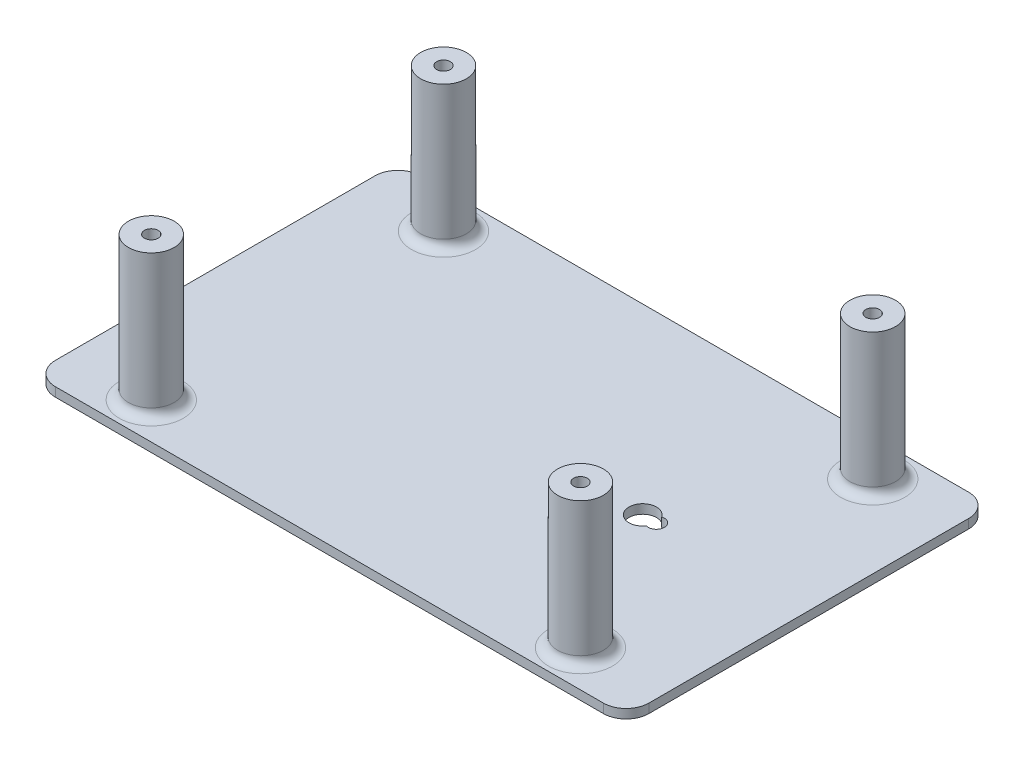
from build123d import *

# Parameters (mm, degrees)
EXTRUDE_1_DEPTH     = 2
SKETCH_2_R          = 3.25
CUT_EXTRUDE_1_DEPTH = 2
EXTRUDE_START       = 31.4
SKETCH_5_R          = 5
SKETCH_5_R_2        = 3.25
EXTRUDE_2_DEPTH     = 31.4
FILLET_1_R          = 2
SKETCH_6_R          = 4.098076989
SKETCH_6_R_2        = 1.5
SKETCH_6_R_3        = 4.302303052
SKETCH_6_R_4        = 4.211102699
SKETCH_6_R_5        = 4.115212329
EXTRUDE_3_DEPTH     = 15
FILLET_2_R          = 2
CUT_EXTRUDE_2_DEPTH = 15


with BuildPart() as part:
    # Эскиз1 → Бобышка-Вытянуть1 (new body)
    with BuildSketch(Plane(origin=(0, 0, 0), x_dir=(1, 0, 0), z_dir=(0, 1, 0))):
        with BuildLine():
            Line((-60, 40), (60, 40))
            ThreePointArc((60, 40), (63.535533906, 38.535533906), (65, 35))
            Line((65, 35), (65, -35))
            ThreePointArc((65, -35), (63.535533906, -38.535533906), (60, -40))
            Line((60, -40), (-60, -40))
            ThreePointArc((-60, -40), (-63.535533906, -38.535533906), (-65, -35))
            Line((-65, -35), (-65, 35))
            ThreePointArc((-65, 35), (-63.535533906, 38.535533906), (-60, 40))
        make_face()
    extrude(amount=EXTRUDE_1_DEPTH)

    # Эскиз2 → Вырез-Вытянуть1 (cut)
    with BuildSketch(Plane(origin=(0, 2, 0), x_dir=(1, 0, 0), z_dir=(0, 1, 0))):
        with Locations(Location((-47, 32, 0), (0, 0, 270))):
            Circle(SKETCH_2_R)
        with Locations(Location((47, 32, 0), (0, 0, 270))):
            Circle(SKETCH_2_R)
        with Locations(Location((-47, -32, 0), (0, 0, 270))):
            Circle(SKETCH_2_R)
        with Locations(Location((47, -32, 0), (0, 0, 270))):
            Circle(SKETCH_2_R)
    extrude(amount=-CUT_EXTRUDE_1_DEPTH, mode=Mode.SUBTRACT)

    # Эскиз5 → Бобышка-Вытянуть2 (add)
    # profile 1 of 4: a face of its own
    with BuildSketch(Plane(origin=(0, 2, 0), x_dir=(1, 0, 0), z_dir=(0, 1, 0)).offset(EXTRUDE_START)):
        with Locations(Location((-47, 32, 0), (0, 0, 90))):
            Circle(SKETCH_5_R)
        with Locations(Location((-47, 32, 0), (0, 0, 270))):
            Circle(SKETCH_5_R_2, mode=Mode.SUBTRACT)
    # profile 2 of 4: a face of its own
    with BuildSketch(Plane(origin=(0, 2, 0), x_dir=(1, 0, 0), z_dir=(0, 1, 0)).offset(EXTRUDE_START)):
        with Locations(Location((47, 32, 0), (0, 0, 90))):
            Circle(SKETCH_5_R)
        with Locations(Location((47, 32, 0), (0, 0, 270))):
            Circle(SKETCH_5_R_2, mode=Mode.SUBTRACT)
    # profile 3 of 4: a face of its own
    with BuildSketch(Plane(origin=(0, 2, 0), x_dir=(1, 0, 0), z_dir=(0, 1, 0)).offset(EXTRUDE_START)):
        with Locations(Location((47, -32, 0), (0, 0, 90))):
            Circle(SKETCH_5_R)
        with Locations(Location((47, -32, 0), (0, 0, 270))):
            Circle(SKETCH_5_R_2, mode=Mode.SUBTRACT)
    # profile 4 of 4: a face of its own
    with BuildSketch(Plane(origin=(0, 2, 0), x_dir=(1, 0, 0), z_dir=(0, 1, 0)).offset(EXTRUDE_START)):
        with Locations(Location((-47, -32, 0), (0, 0, 90))):
            Circle(SKETCH_5_R)
        with Locations(Location((-47, -32, 0), (0, 0, 270))):
            Circle(SKETCH_5_R_2, mode=Mode.SUBTRACT)
    extrude(amount=-EXTRUDE_2_DEPTH)

    # Скругление1
    fillet_1_edges = [part.edges().sort_by_distance(p)[0] for p in [
        (-47, 2, -27),
        (47, 2, 37),
        (47, 2, -27),
        (-47, 2, 37),
    ]]
    fillet(fillet_1_edges, radius=FILLET_1_R)

    # Эскиз6 → Бобышка-Вытянуть3 (add)
    # profile 1 of 4: a face of its own
    with BuildSketch(Plane(origin=(0, 33.4, 0), x_dir=(1, 0, 0), z_dir=(0, 1, 0))):
        with Locations((-47, 32)):
            Circle(SKETCH_6_R)
        with Locations(Location((-47, 32, 0), (0, 0, 270))):
            Circle(SKETCH_6_R_2, mode=Mode.SUBTRACT)
    # profile 2 of 4: a face of its own
    with BuildSketch(Plane(origin=(0, 33.4, 0), x_dir=(1, 0, 0), z_dir=(0, 1, 0))):
        with Locations((47, 32)):
            Circle(SKETCH_6_R_3)
        with Locations(Location((47, 32, 0), (0, 0, 270))):
            Circle(SKETCH_6_R_2, mode=Mode.SUBTRACT)
    # profile 3 of 4: a face of its own
    with BuildSketch(Plane(origin=(0, 33.4, 0), x_dir=(1, 0, 0), z_dir=(0, 1, 0))):
        with Locations((47, -32)):
            Circle(SKETCH_6_R_4)
        with Locations(Location((47, -32, 0), (0, 0, 270))):
            Circle(SKETCH_6_R_2, mode=Mode.SUBTRACT)
    # profile 4 of 4: a face of its own
    with BuildSketch(Plane(origin=(0, 33.4, 0), x_dir=(1, 0, 0), z_dir=(0, 1, 0))):
        with Locations((-47, -32)):
            Circle(SKETCH_6_R_5)
        with Locations(Location((-47, -32, 0), (0, 0, 270))):
            Circle(SKETCH_6_R_2, mode=Mode.SUBTRACT)
    extrude(amount=-EXTRUDE_3_DEPTH)

    # Скругление2
    fillet_2_edges = [part.edges().sort_by_distance(p)[0] for p in [
        (47, 0, -35.25),
        (-47, 0, 28.75),
        (47, 0, 28.75),
        (-47, 0, -35.25),
    ]]
    fillet(fillet_2_edges, radius=FILLET_2_R)

    # Эскиз7 → Вырез-Вытянуть2 (cut)
    with BuildSketch(Plane.XZ):
        with BuildLine():
            ThreePointArc((31.112033157, 1.673910041), (25.622449823, 0), (31.112033157, -1.673910041))
            ThreePointArc((31.112033157, -1.673910041), (33.372449823, 0), (31.112033157, 1.673910041))
        make_face()
    extrude(amount=-CUT_EXTRUDE_2_DEPTH, mode=Mode.SUBTRACT)


solid = part.part
